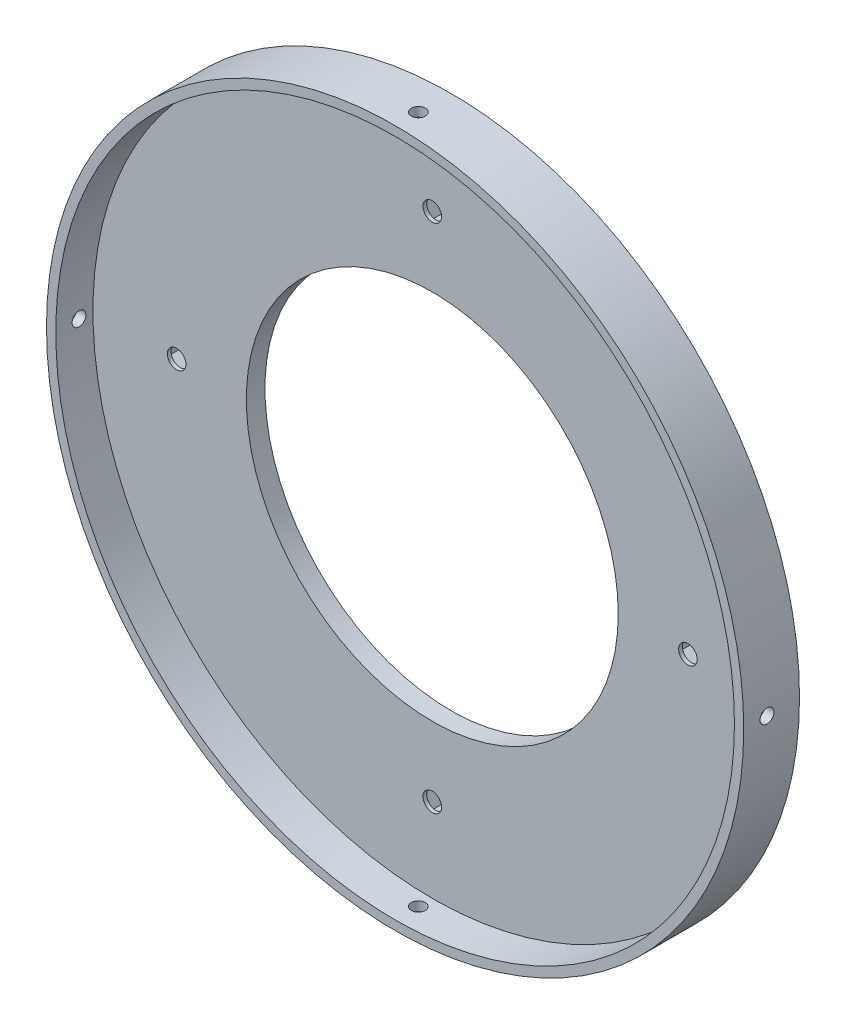
from build123d import *

# Parameters (mm, degrees)
SKETCH1_R               = 75
SKETCH1_R_2             = 40
BOSS_EXTRUDE1_DEPTH     = 4
SKETCH2_R               = 75
SKETCH2_R_2             = 73
BOSS_EXTRUDE2_DEPTH     = 8
CUT_EXTRUDE1_REACH      = 108.743
CUT_EXTRUDE1_END_RADIUS = 75
SKETCH3_R               = 1.5
CIRPATTERN1_COUNT       = 4
F_4_0MM_DOWEL_HOLE1_D   = 4
CUT_EXTRUDE2_DEPTH      = 3.2


with BuildPart() as part:
    # Sketch1 → Boss-Extrude1 (new body)
    with BuildSketch(Plane.XY):
        Circle(SKETCH1_R)
        Circle(SKETCH1_R_2, mode=Mode.SUBTRACT)
    extrude(amount=BOSS_EXTRUDE1_DEPTH)

    # Sketch2 → Boss-Extrude2 (add)
    with BuildSketch(Plane.XY.offset(4)):
        Circle(SKETCH2_R)
        Circle(SKETCH2_R_2, mode=Mode.SUBTRACT)
    extrude(amount=BOSS_EXTRUDE2_DEPTH)

    # Cut-Extrude1: up to this cylinder (the profile starts inside it)
    cut_extrude1_end = Plane(origin=(0, 0, 7), z_dir=(0, 0, -1)) * Cylinder(CUT_EXTRUDE1_END_RADIUS, 368.486, mode=Mode.PRIVATE)
    # Sketch3 → Cut-Extrude1 (cut, up to the surface)
    with BuildSketch(Plane(origin=(0, 0, 0), x_dir=(1, 0, 0), z_dir=(0, 1, 0)), mode=Mode.PRIVATE) as cut_extrude1_sk1:
        with Locations(Location((0, -7, 0), (0, 0, 270))):
            Circle(SKETCH3_R)
    cut_extrude1_tool1 = extrude(cut_extrude1_sk1.sketch, amount=-CUT_EXTRUDE1_REACH, mode=Mode.PRIVATE) & cut_extrude1_end
    cut_extrude1 = cut_extrude1_tool1.solids().sort_by_distance((0, 0, 7))[0]
    add(cut_extrude1, mode=Mode.SUBTRACT)

    # CirPattern1: Cut-Extrude1 ×4 about axis
    cirpattern1_axis = Axis((0, 0, 4), (0, 0, -1))
    for i in range(1, CIRPATTERN1_COUNT):
        add(cut_extrude1.rotate(cirpattern1_axis, i * 360 / CIRPATTERN1_COUNT), mode=Mode.SUBTRACT)

    # Ø4.0mm Dowel Hole1 (through all)
    with Locations(Plane(origin=(0, 0, 0), x_dir=(-1, 0, 0), z_dir=(0, 0, -1))):
        with Locations((0, 55), (55, 0), (0, -55), (-55, 0)):
            Hole(F_4_0MM_DOWEL_HOLE1_D / 2)

    # Sketch13 → Cut-Extrude2 (cut)
    with BuildSketch(Plane(origin=(0, 0, 0), x_dir=(-1, 0, 0), z_dir=(0, 0, -1))):
        Polygon((4.041451884, 55), (2.020725942, 58.5), (-2.020725942, 58.5), (-4.041451884, 55), (-2.020725942, 51.5), (2.020725942, 51.5), align=None)
        Polygon((55, -4.041451884), (58.5, -2.020725942), (58.5, 2.020725942), (55, 4.041451884), (51.5, 2.020725942), (51.5, -2.020725942), align=None)
        Polygon((-4.041451884, -55), (-2.020725942, -58.5), (2.020725942, -58.5), (4.041451884, -55), (2.020725942, -51.5), (-2.020725942, -51.5), align=None)
        Polygon((-55, 4.041451884), (-58.5, 2.020725942), (-58.5, -2.020725942), (-55, -4.041451884), (-51.5, -2.020725942), (-51.5, 2.020725942), align=None)
    extrude(amount=-CUT_EXTRUDE2_DEPTH, mode=Mode.SUBTRACT)


solid = part.part
